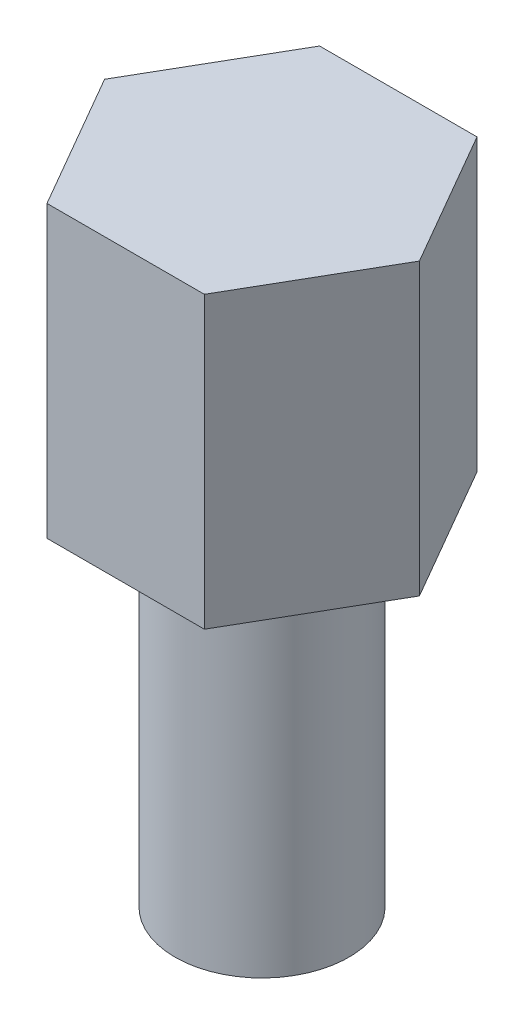
from build123d import *

# Parameters (mm, degrees)
EXTRUDE_1_DEPTH = 5
SKETCH_2_R      = 1.5
EXTRUDE_2_DEPTH = 6


with BuildPart() as part:
    # 草图1 → 凸台-拉伸1 (new body)
    with BuildSketch(Plane(origin=(0, 0, 0), x_dir=(1, 0, 0), z_dir=(0, 1, 0))):
        Polygon((-1.356773133, 2.35), (-2.713546265, 0), (-1.356773133, -2.35), (1.356773133, -2.35), (2.713546265, 0), (1.356773133, 2.35), align=None)
    extrude(amount=EXTRUDE_1_DEPTH)

    # 草图2 → 凸台-拉伸2 (add)
    with BuildSketch(Plane.XZ):
        with Locations(Location((0, 0, 0), (0, 0, 90))):
            Circle(SKETCH_2_R)
    extrude(amount=EXTRUDE_2_DEPTH)


solid = part.part
